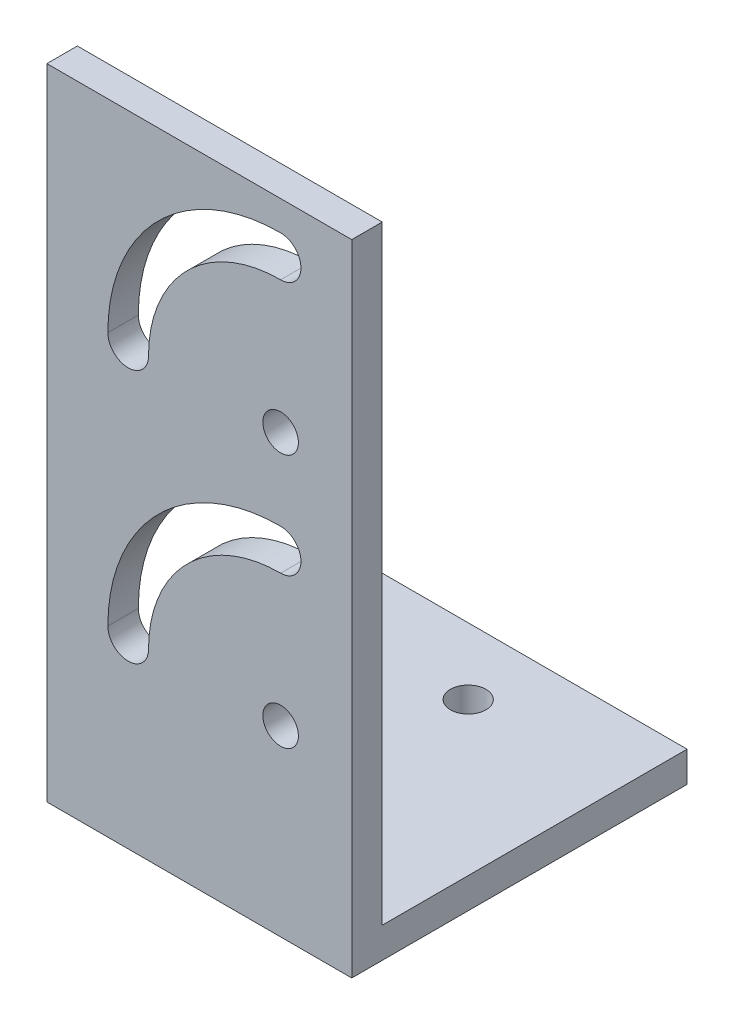
from build123d import *

# Parameters (mm, degrees)
SKETCH_1_W          = 30
SKETCH_1_H          = 30
EXTRUDE_1_DEPTH     = 3
SKETCH_2_R          = 1.75
CUT_EXTRUDE_1_DEPTH = 3
SKETCH_3_W          = 30
SKETCH_3_H          = 62.924190463
EXTRUDE_2_DEPTH     = 3
SKETCH_4_R          = 1.75
CUT_EXTRUDE_2_DEPTH = 3


with BuildPart() as part:
    # 草图1 → 凸台-拉伸1 (new body)
    with BuildSketch(Plane(origin=(0, 0, 0), x_dir=(1, 0, 0), z_dir=(0, 1, 0))):
        Rectangle(SKETCH_1_W, SKETCH_1_H)
    extrude(amount=EXTRUDE_1_DEPTH)

    # 草图2 → 切除-拉伸1 (cut)
    with BuildSketch(Plane(origin=(0, 3, 0), x_dir=(1, 0, 0), z_dir=(0, 1, 0))):
        with Locations(Location((0, -6.542683553, 0), (0, 0, 270))):
            Circle(SKETCH_2_R)
        with Locations(Location((0, 8.457316447, 0), (0, 0, 270))):
            Circle(SKETCH_2_R)
    extrude(amount=-CUT_EXTRUDE_1_DEPTH, mode=Mode.SUBTRACT)

    # 草图3 → 凸台-拉伸2 (add)
    with BuildSketch(Plane.XY.offset(15)):
        with Locations((0, 31.462095232)):
            Rectangle(SKETCH_3_W, SKETCH_3_H)
    extrude(amount=EXTRUDE_2_DEPTH)

    # 草图4 → 切除-拉伸2 (cut)
    with BuildSketch(Plane.XY.offset(18)):
        with Locations(Location((8, 43, 0), (0, 0, 180))):
            Circle(SKETCH_4_R)
        with Locations(Location((8, 18, 0), (0, 0, 180))):
            Circle(SKETCH_4_R)
        with BuildLine():
            ThreePointArc((8, 60), (10, 58), (8, 56))
            ThreePointArc((8, 56), (-1.192388155, 52.192388155), (-5, 43))
            ThreePointArc((-5, 43), (-7, 41), (-9, 43))
            ThreePointArc((-9, 43), (-4.02081528, 55.02081528), (8, 60))
        make_face()
        with BuildLine():
            ThreePointArc((-5, 18), (-7, 16), (-9, 18))
            ThreePointArc((-9, 18), (-4.02081528, 30.02081528), (8, 35))
            ThreePointArc((8, 35), (10, 33), (8, 31))
            ThreePointArc((8, 31), (-1.192388155, 27.192388155), (-5, 18))
        make_face()
    extrude(amount=-CUT_EXTRUDE_2_DEPTH, mode=Mode.SUBTRACT)


solid = part.part
